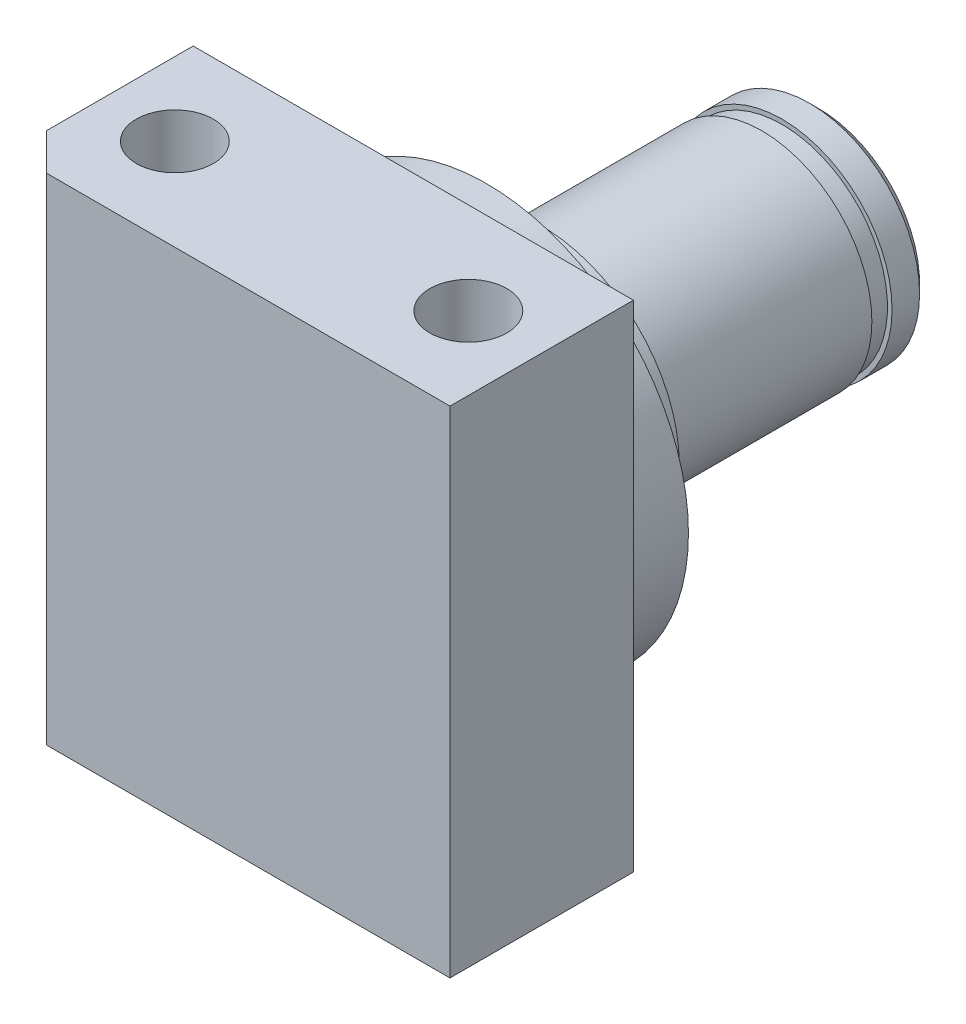
from build123d import *

# Parameters (mm, degrees)
SKETCH_1_W          = 24
SKETCH_1_H          = 27
EXTRUDE_1_DEPTH     = 10
SKETCH_4_R          = 2.1
CUT_EXTRUDE_2_DEPTH = 37.013519789
SKETCH_2_R          = 11
EXTRUDE_2_DEPTH     = 4
SKETCH_5_R          = 7.5
EXTRUDE_3_DEPTH     = 3
SKETCH_6_R          = 5.75
EXTRUDE_4_DEPTH     = 0.5
SKETCH_7_R          = 6
EXTRUDE_5_DEPTH     = 11.5
SKETCH_8_R          = 5.75
EXTRUDE_6_DEPTH     = 1.1
SKETCH_9_R          = 6
EXTRUDE_7_DEPTH     = 2
CHAMFER_1_SIZE      = 0.5
CHAMFER_2_SIZE      = 2


with BuildPart() as part:
    # 草图1 → 凸台-拉伸1 (new body)
    with BuildSketch(Plane.XY):
        Rectangle(SKETCH_1_W, SKETCH_1_H)
    extrude(amount=EXTRUDE_1_DEPTH)

    # 草图4 → 切除-拉伸2 (cut)
    with BuildSketch(Plane(origin=(0, 13.5, 0), x_dir=(1, 0, 0), z_dir=(0, 1, 0))):
        with Locations(Location((-8, -5, 0), (0, 0, 270))):
            Circle(SKETCH_4_R)
        with Locations(Location((8, -5, 0), (0, 0, 270))):
            Circle(SKETCH_4_R)
    extrude(amount=-CUT_EXTRUDE_2_DEPTH, mode=Mode.SUBTRACT)

    # 草图2 → 凸台-拉伸2 (add)
    with BuildSketch(Plane.XY):
        Circle(SKETCH_2_R)
    extrude(amount=-EXTRUDE_2_DEPTH)

    # 草图5 → 凸台-拉伸3 (add)
    with BuildSketch(Plane(origin=(0, 0, -4), x_dir=(-1, 0, 0), z_dir=(0, 0, -1))):
        with Locations(Location((0, 0, 0), (0, 0, 180))):
            Circle(SKETCH_5_R)
    extrude(amount=EXTRUDE_3_DEPTH)

    # 草图6 → 凸台-拉伸4 (add)
    with BuildSketch(Plane(origin=(0, 0, -7), x_dir=(-1, 0, 0), z_dir=(0, 0, -1))):
        Circle(SKETCH_6_R)
    extrude(amount=EXTRUDE_4_DEPTH)

    # 草图7 → 凸台-拉伸5 (add)
    with BuildSketch(Plane(origin=(0, 0, -7.5), x_dir=(-1, 0, 0), z_dir=(0, 0, -1))):
        Circle(SKETCH_7_R)
    extrude(amount=EXTRUDE_5_DEPTH)

    # 草图8 → 凸台-拉伸6 (add)
    with BuildSketch(Plane(origin=(0, 0, -19), x_dir=(-1, 0, 0), z_dir=(0, 0, -1))):
        Circle(SKETCH_8_R)
    extrude(amount=EXTRUDE_6_DEPTH)

    # 草图9 → 凸台-拉伸7 (add)
    with BuildSketch(Plane(origin=(0, 0, -20.1), x_dir=(-1, 0, 0), z_dir=(0, 0, -1))):
        Circle(SKETCH_9_R)
    extrude(amount=EXTRUDE_7_DEPTH)

    # 倒角1
    chamfer_1_edges = [part.edges().sort_by_distance(p)[0] for p in [
        (6, 0, -22.1),
    ]]
    chamfer(chamfer_1_edges, length=CHAMFER_1_SIZE)

    # 倒角2
    chamfer_2_edges = [part.edges().sort_by_distance(p)[0] for p in [
        (-12, 0, 10),
    ]]
    chamfer(chamfer_2_edges, length=CHAMFER_2_SIZE)


solid = part.part
